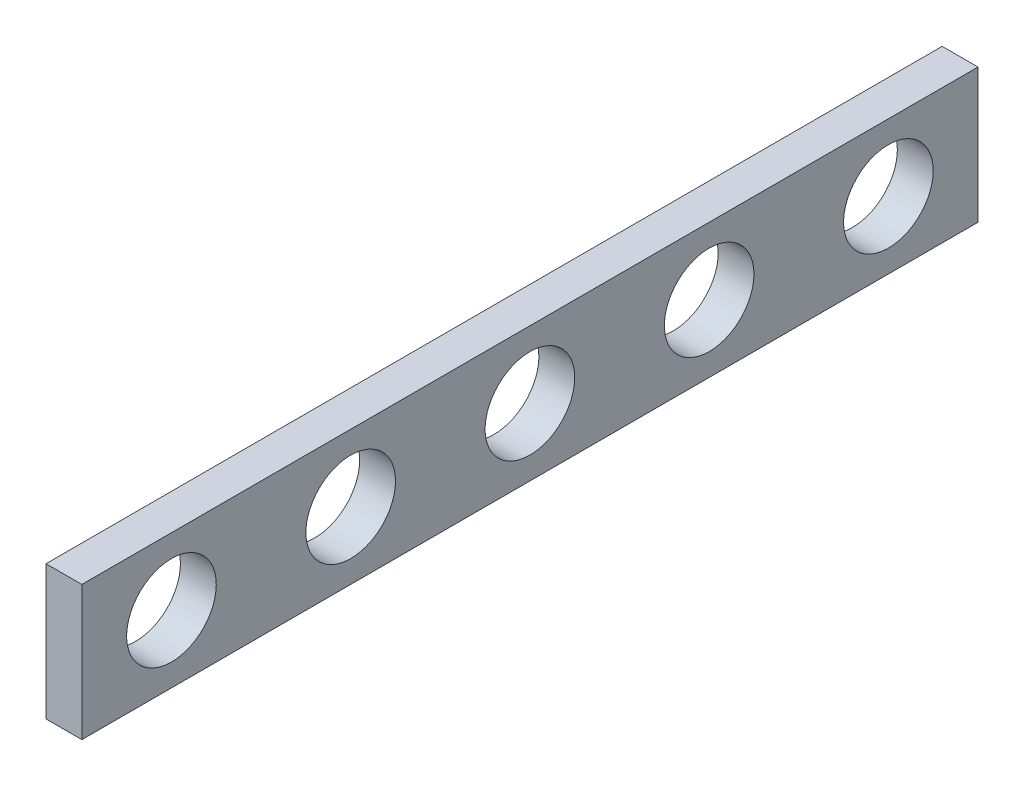
from build123d import *

# Parameters (mm, degrees)
SKETCH1_W           = 500
SKETCH1_H           = 75
SKETCH1_R           = 25
BOSS_EXTRUDE1_DEPTH = 20


with BuildPart() as part:
    # Sketch1 → Boss-Extrude1 (new body)
    with BuildSketch(Plane(origin=(0, 0, 0), x_dir=(0, 0, -1), z_dir=(1, 0, 0))):
        Rectangle(SKETCH1_W, SKETCH1_H)
        Circle(SKETCH1_R, mode=Mode.SUBTRACT)
        with Locations((100, 0)):
            Circle(SKETCH1_R, mode=Mode.SUBTRACT)
        with Locations((200, 0)):
            Circle(SKETCH1_R, mode=Mode.SUBTRACT)
        with Locations((-100, 0)):
            Circle(SKETCH1_R, mode=Mode.SUBTRACT)
        with Locations((-200, 0)):
            Circle(SKETCH1_R, mode=Mode.SUBTRACT)
    extrude(amount=BOSS_EXTRUDE1_DEPTH)


solid = part.part
